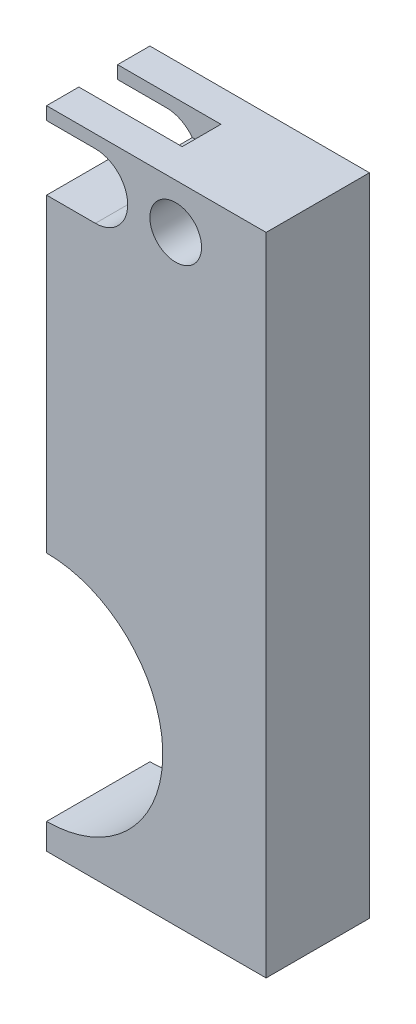
from build123d import *

# Parameters (mm, degrees)
BOSS_EXTRUDE1_DEPTH = 8
SKETCH2_R           = 2
CUT_EXTRUDE1_DEPTH  = 8
SKETCH3_W           = 8
SKETCH3_H           = 3
CUT_EXTRUDE2_DEPTH  = 2


with BuildPart() as part:
    # Sketch1 → Boss-Extrude1 (new body)
    with BuildSketch(Plane.XY):
        with BuildLine():
            Line((0.688022284, 7.008356546), (0.688022284, -15.991643454))
            ThreePointArc((0.688022284, -15.991643454), (9.688022284, -24.991643454), (0.688022284, -33.991643454))
            Line((0.688022284, -33.991643454), (0.688022284, -35.991643454))
            Line((0.688022284, -35.991643454), (17.688022284, -35.991643454))
            Line((17.688022284, -35.991643454), (17.688022284, 14.008356546))
            Line((17.688022284, 14.008356546), (0.688022284, 14.008356546))
            Line((0.688022284, 14.008356546), (0.688022284, 13.008356546))
            Line((0.688022284, 13.008356546), (4.46794824, 13.008356546))
            ThreePointArc((4.46794824, 13.008356546), (6.96794824, 10.508356546), (4.46794824, 8.008356546))
            Line((4.46794824, 8.008356546), (0.688022284, 8.008356546))
            Line((0.688022284, 8.008356546), (0.688022284, 7.008356546))
        make_face()
    extrude(amount=BOSS_EXTRUDE1_DEPTH)

    # Sketch2 → Cut-Extrude1 (cut)
    with BuildSketch(Plane.XY.offset(8)):
        with Locations((10.688022284, 10.508356546)):
            Circle(SKETCH2_R)
    extrude(amount=-CUT_EXTRUDE1_DEPTH, mode=Mode.SUBTRACT)

    # Sketch3 → Cut-Extrude2 (cut)
    with BuildSketch(Plane(origin=(0, 14.008356546, 0), x_dir=(1, 0, 0), z_dir=(0, 1, 0))):
        with Locations((4.688022284, -4)):
            Rectangle(SKETCH3_W, SKETCH3_H)
    extrude(amount=-CUT_EXTRUDE2_DEPTH, mode=Mode.SUBTRACT)


solid = part.part
